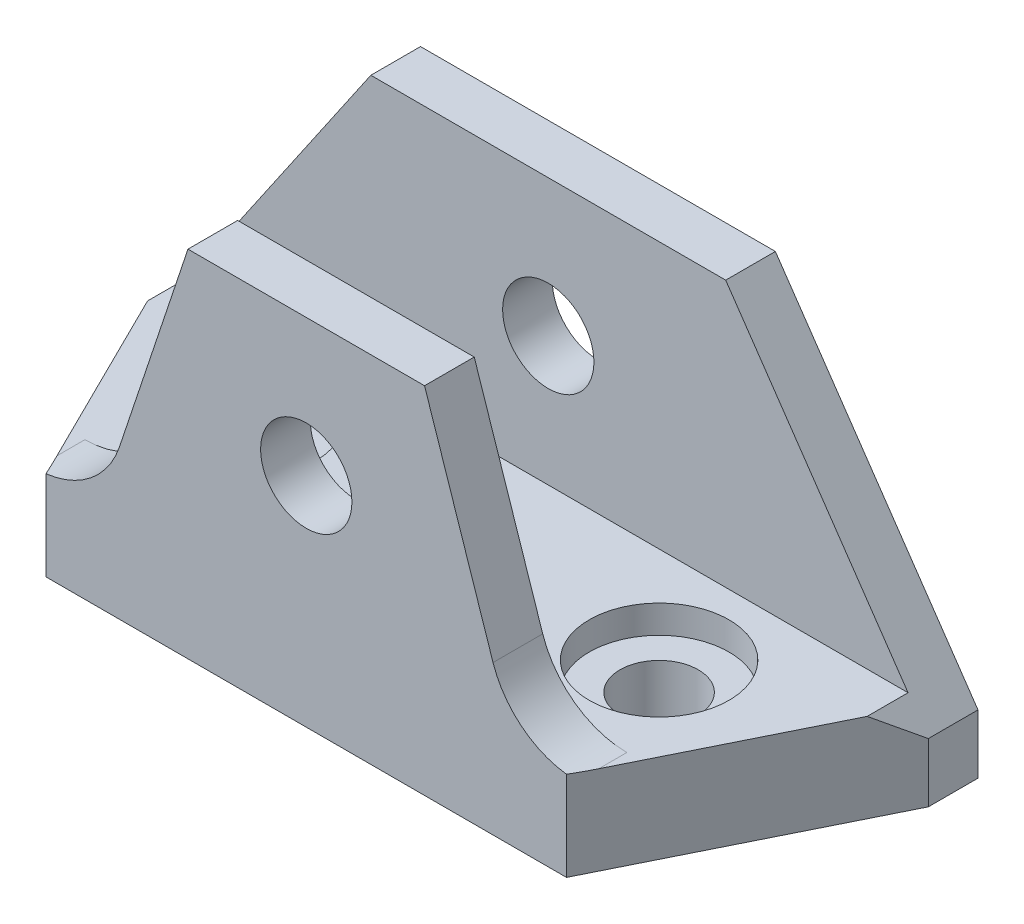
from build123d import *

# Parameters (mm, degrees)
BOSS_EXTRUDE1_DEPTH                     = 38.1
SKETCH2_W                               = 88.9
SKETCH2_H                               = 20.6502
CUT_EXTRUDE1_DEPTH                      = 28.575
CBORE_FOR_M8_HEX_HEAD_BOLT2_D           = 8.4
CBORE_FOR_M8_HEX_HEAD_BOLT2_CBORE_D     = 15
CBORE_FOR_M8_HEX_HEAD_BOLT2_CBORE_DEPTH = 3
CUT_EXTRUDE4_REACH                      = 66.902
FILLET1_R                               = 9.525
CUT_EXTRUDE5_START                      = -11.760877
CUT_EXTRUDE5_DEPTH                      = 11.760877
W_0_386_DIAMETER_HOLE1_D                = 9.8044
CUT_EXTRUDE7_REACH                      = 93.785
SKETCH14_W                              = 2.032
SKETCH14_H                              = 38.1


with BuildPart() as part:
    # Sketch1 → Boss-Extrude1 (new body)
    with BuildSketch(Plane(origin=(0, 0, 0), x_dir=(1, 0, 0), z_dir=(0, 1, 0))):
        Polygon((26.936371436, -17.6911), (-26.936371436, -17.6911), (-44.45, 17.6911), (44.45, 17.6911), align=None)
    extrude(amount=BOSS_EXTRUDE1_DEPTH)

    # Sketch2 → Cut-Extrude1 (cut)
    with BuildSketch(Plane(origin=(0, 38.1, 0), x_dir=(1, 0, 0), z_dir=(0, 1, 0))):
        Rectangle(SKETCH2_W, SKETCH2_H)
    extrude(amount=-CUT_EXTRUDE1_DEPTH, mode=Mode.SUBTRACT)

    # CBORE for M8 Hex Head Bolt2 (through all)
    with Locations(Plane(origin=(0, 9.525, 0), x_dir=(1, 0, 0), z_dir=(0, 1, 0))):
        with Locations((-22.225, 0), (22.225, 0)):
            CounterBoreHole(CBORE_FOR_M8_HEX_HEAD_BOLT2_D / 2, CBORE_FOR_M8_HEX_HEAD_BOLT2_CBORE_D / 2, CBORE_FOR_M8_HEX_HEAD_BOLT2_CBORE_DEPTH)

    # Sketch9 → Cut-Extrude4 (cut, up to next)
    with BuildSketch(Plane(origin=(0, 0, 10.3251), x_dir=(-1, 0, 0), z_dir=(0, 0, -1)), mode=Mode.PRIVATE) as cut_extrude4_sk1:
        Polygon((12.7, 38.1), (22.225, 9.525), (30.582424762, 9.525), (30.582424762, 38.1), align=None)
    cut_extrude4_tool1 = extrude(cut_extrude4_sk1.sketch, amount=-CUT_EXTRUDE4_REACH, mode=Mode.PRIVATE) & part.part
    # Sketch9 → Cut-Extrude4 (cut, up to next)
    with BuildSketch(Plane(origin=(0, 0, 10.3251), x_dir=(-1, 0, 0), z_dir=(0, 0, -1)), mode=Mode.PRIVATE) as cut_extrude4_sk2:
        Polygon((-30.582424762, 9.525), (-22.225, 9.525), (-12.7, 38.1), (-30.582424762, 38.1), align=None)
    cut_extrude4_tool2 = extrude(cut_extrude4_sk2.sketch, amount=-CUT_EXTRUDE4_REACH, mode=Mode.PRIVATE) & part.part
    add(cut_extrude4_tool1.solids().sort_by_distance((-23.734333, 25.541276, 10.3251))[0], mode=Mode.SUBTRACT)
    add(cut_extrude4_tool2.solids().sort_by_distance((23.734333, 25.541276, 10.3251))[0], mode=Mode.SUBTRACT)

    # Fillet1
    fillet1_edges = [part.edges().sort_by_distance(p)[0] for p in [
        (-22.225, 9.525, 14.0081),
        (22.225, 9.525, 14.0081),
    ]]
    fillet(fillet1_edges, radius=FILLET1_R)

    # Sketch10 → Cut-Extrude5 (cut)
    with BuildSketch(Plane(origin=(0, 0, -17.6911), x_dir=(-1, 0, 0), z_dir=(0, 0, -1)).offset(CUT_EXTRUDE5_START)):
        Polygon((-40.803946674, 6.35), (-19.05, 38.1), (-44.45, 38.1), (-44.45, 0), (-40.803946674, 0), align=None)
        Polygon((44.45, 38.1), (19.05, 38.1), (40.803946674, 6.35), (40.803946674, 0), (44.45, 0), align=None)
    extrude(amount=CUT_EXTRUDE5_DEPTH, mode=Mode.SUBTRACT)

    # W (0.386) Diameter Hole1 (through all)
    with Locations(Plane.XY.offset(17.6911)):
        with Locations((0, 23.392384)):
            Hole(W_0_386_DIAMETER_HOLE1_D / 2)

    # Cut-Extrude7: up to this face of the body (flat: up to its plane)
    cut_extrude7_end = Plane(part.part.faces().sort_by_distance((-40.803946674, 3.175, -14.0081))[0])
    # Sketch14 → Cut-Extrude7 (cut, up to the picked face)
    with BuildSketch(Plane(origin=(40.803946674, 0, 0), x_dir=(0, 0, -1), z_dir=(1, 0, 0)), mode=Mode.PRIVATE) as cut_extrude7_sk1:
        with Locations((-16.6751, 19.05)):
            Rectangle(SKETCH14_W, SKETCH14_H)
    cut_extrude7_tool1 = split(extrude(cut_extrude7_sk1.sketch, amount=-CUT_EXTRUDE7_REACH, mode=Mode.PRIVATE), bisect_by=cut_extrude7_end, keep=Keep.BOTH, mode=Mode.PRIVATE)
    # Sketch14 → Cut-Extrude7 (cut, up to the picked face)
    with BuildSketch(Plane(origin=(40.803946674, 0, 0), x_dir=(0, 0, -1), z_dir=(1, 0, 0)), mode=Mode.PRIVATE) as cut_extrude7_sk2:
        with Locations((16.6751, 19.05)):
            Rectangle(SKETCH14_W, SKETCH14_H)
    cut_extrude7_tool2 = split(extrude(cut_extrude7_sk2.sketch, amount=-CUT_EXTRUDE7_REACH, mode=Mode.PRIVATE), bisect_by=cut_extrude7_end, keep=Keep.BOTH, mode=Mode.PRIVATE)
    add(cut_extrude7_tool1.solids().sort_by(Axis((40.803947, 19.05, 16.6751), (-1, 0, 0)))[0], mode=Mode.SUBTRACT)
    add(cut_extrude7_tool2.solids().sort_by(Axis((40.803947, 19.05, -16.6751), (-1, 0, 0)))[0], mode=Mode.SUBTRACT)


solid = part.part
